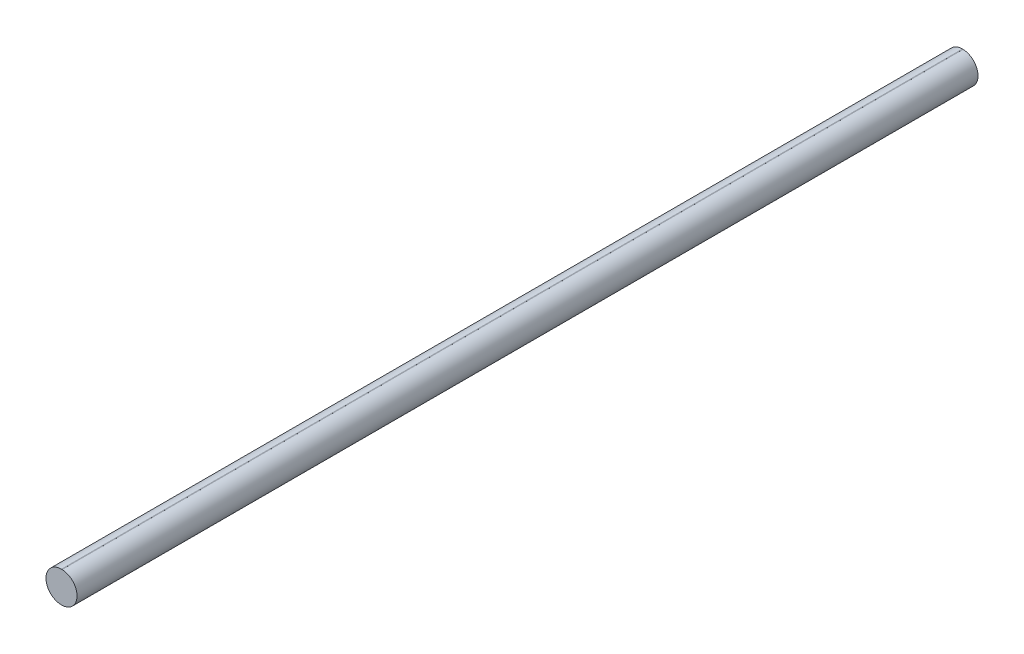
from build123d import *

# Parameters (mm, degrees)
SKETCH2_R           = 3.175
BOSS_EXTRUDE1_DEPTH = 184.15
SKETCH4_W           = 0.123608439
SKETCH4_H           = 6.347592939
BOSS_EXTRUDE2_DEPTH = 184.15


with BuildPart() as part:
    # Sketch2 → Boss-Extrude1 (new body)
    with BuildSketch(Plane.XY):
        Circle(SKETCH2_R)
    extrude(amount=BOSS_EXTRUDE1_DEPTH)

    # Sketch4 → Boss-Extrude2 (add)
    with BuildSketch(Plane.XY.offset(184.15)):
        with Locations((0.06180422, 0.00120353)):
            Rectangle(SKETCH4_W, SKETCH4_H)
    extrude(amount=-BOSS_EXTRUDE2_DEPTH)


solid = part.part
